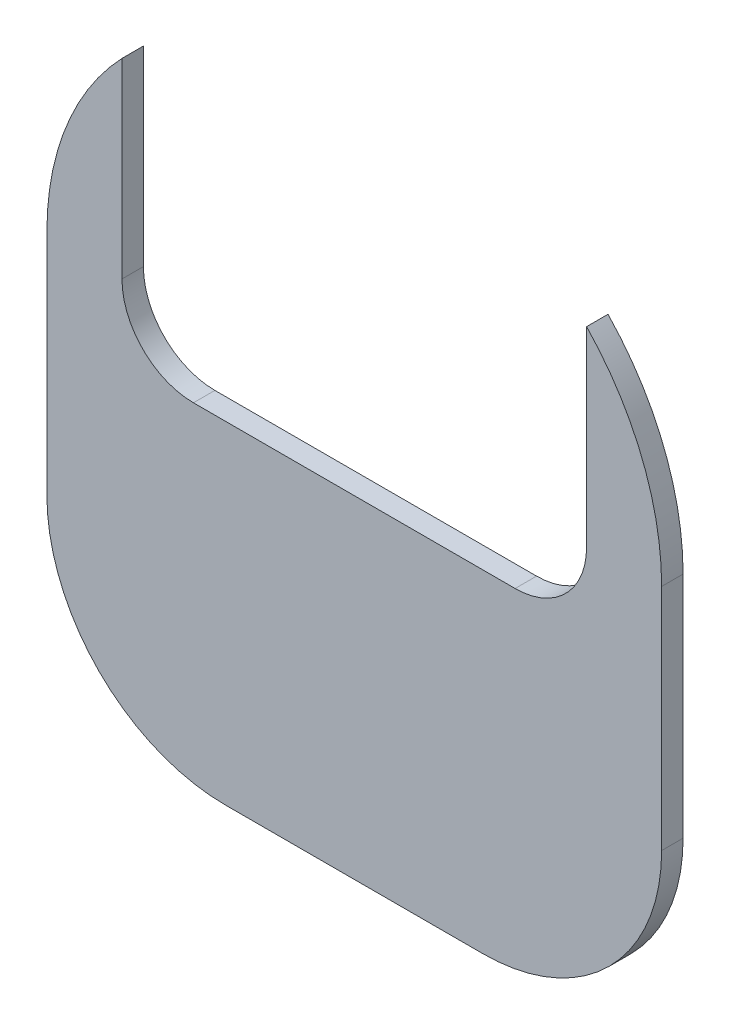
from build123d import *

# Parameters (mm, degrees)
BOSS_EXTRUDE1_DEPTH = 3
CUT_EXTRUDE1_DEPTH  = 10


with BuildPart() as part:
    # Sketch1 → Boss-Extrude1 (new body)
    with BuildSketch(Plane.XY):
        with BuildLine():
            Line((-5, 8.5), (5, 8.5))
            ThreePointArc((5, 8.5), (31.870057685, -2.629942315), (43, -29.5))
            Line((43, -29.5), (43, -61.5))
            ThreePointArc((43, -61.5), (35.67766953, -79.17766953), (18, -86.5))
            Line((18, -86.5), (0.5, -86.5))
            Line((0.5, -86.5), (-0.5, -86.5))
            Line((-0.5, -86.5), (-18, -86.5))
            ThreePointArc((-18, -86.5), (-35.67766953, -79.17766953), (-43, -61.5))
            Line((-43, -61.5), (-43, -29.5))
            ThreePointArc((-43, -29.5), (-31.870057685, -2.629942315), (-5, 8.5))
        make_face()
    extrude(amount=BOSS_EXTRUDE1_DEPTH)

    # Sketch2 → Cut-Extrude1 (cut)
    with BuildSketch(Plane.XY.offset(3)):
        with BuildLine():
            Line((-22.5, -40), (22.5, -40))
            ThreePointArc((22.5, -40), (29.571067812, -37.071067812), (32.5, -30))
            Line((32.5, -30), (32.5, 20))
            ThreePointArc((32.5, 20), (29.571067812, 27.071067812), (22.5, 30))
            Line((22.5, 30), (-22.5, 30))
            ThreePointArc((-22.5, 30), (-29.571067812, 27.071067812), (-32.5, 20))
            Line((-32.5, 20), (-32.5, -30))
            ThreePointArc((-32.5, -30), (-29.571067812, -37.071067812), (-22.5, -40))
        make_face()
    extrude(amount=-CUT_EXTRUDE1_DEPTH, mode=Mode.SUBTRACT)


solid = part.part
